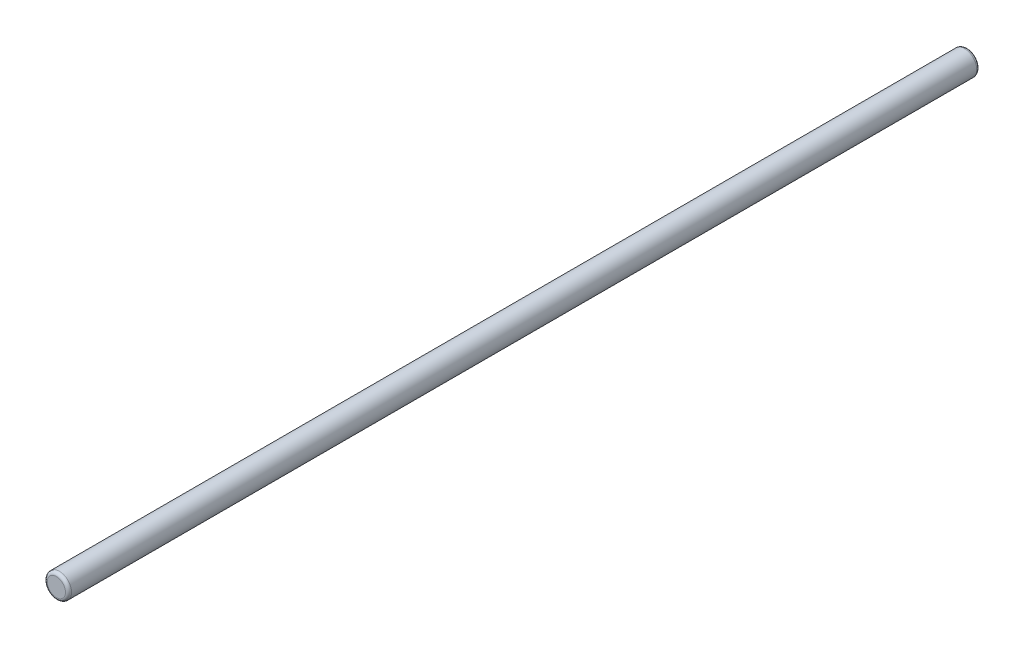
from build123d import *

# Parameters (mm, degrees)
SKETCH1_R           = 4
BOSS_EXTRUDE1_DEPTH = 300
FILLET1_R           = 1


with BuildPart() as part:
    # Sketch1 → Boss-Extrude1 (new body)
    with BuildSketch(Plane.XY):
        Circle(SKETCH1_R)
    extrude(amount=BOSS_EXTRUDE1_DEPTH)

    # Fillet1
    fillet1_edges = [part.edges().sort_by_distance(p)[0] for p in [
        (-4, 0, 0),
        (-4, 0, 300),
    ]]
    fillet(fillet1_edges, radius=FILLET1_R)


solid = part.part
